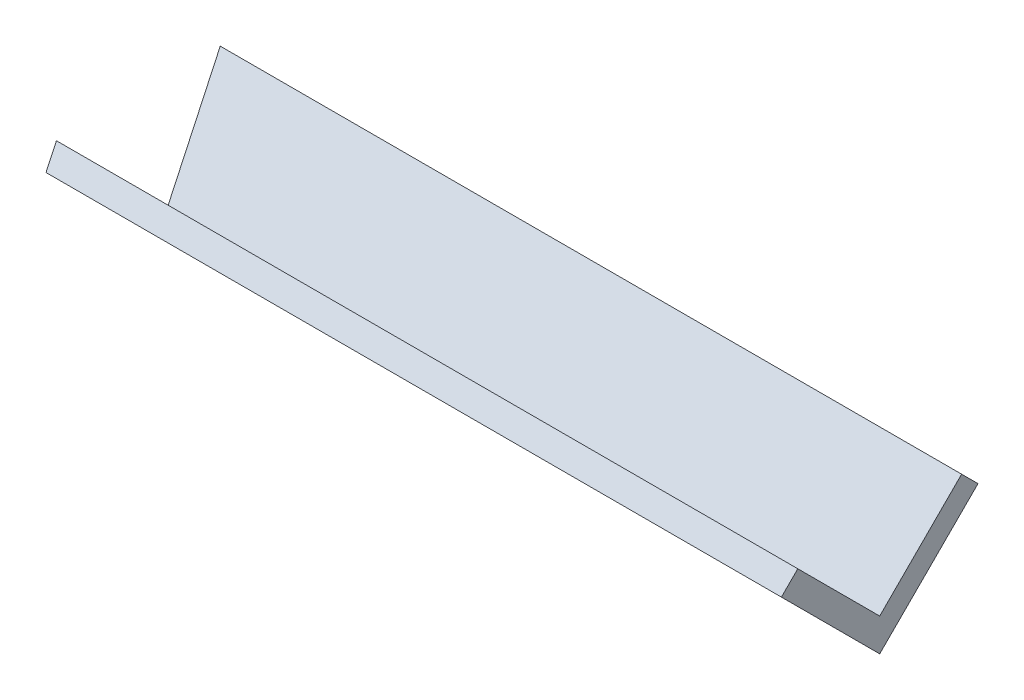
from build123d import *

# Parameters (mm, degrees)
BOSS_EXTRUDE1_DEPTH = 101.6
SKETCH2_W           = 26.940768364
SKETCH2_H           = 16.724030672
CUT_EXTRUDE1_DEPTH  = 99.46706905


with BuildPart() as part:
    # Sketch1 → Boss-Extrude1 (new body)
    with BuildSketch(Plane(origin=(0, 0, 0), x_dir=(0, 0, -1), z_dir=(1, 0, 0))):
        Polygon((0, 0), (-13.470384182, 13.470384182), (-11.225320151, 15.715448212), (0, 4.490128061), (11.225320151, 15.715448212), (13.470384182, 13.470384182), align=None)
    extrude(amount=BOSS_EXTRUDE1_DEPTH)

    # Sketch2 → Cut-Extrude1 (cut, through all)
    with BuildSketch(Plane(origin=(5.050847696, 1.838358219, 0), x_dir=(0, 0, -1), z_dir=(-0.9396926207859081, -0.34202014332566943, 0))):
        with Locations((0, -6.405675381)):
            Rectangle(SKETCH2_W, SKETCH2_H)
    extrude(amount=CUT_EXTRUDE1_DEPTH, mode=Mode.SUBTRACT)


solid = part.part
